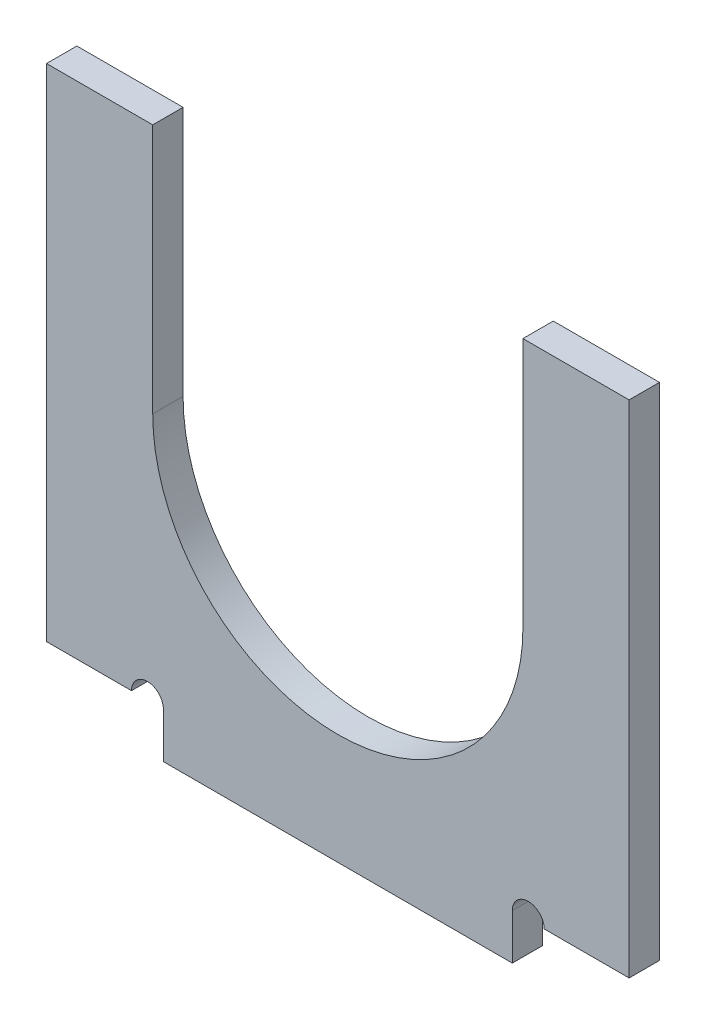
from build123d import *

# Parameters (mm, degrees)
SKETCH_1_W          = 38.4
SKETCH_1_H          = 30
EXTRUDE_1_DEPTH     = 2
CUT_EXTRUDE_1_DEPTH = 2
SKETCH_3_W          = 23
SKETCH_3_H          = 6
EXTRUDE_2_DEPTH     = 2
SKETCH_4_R          = 1.05
CUT_EXTRUDE_2_DEPTH = 2
SKETCH_5_W          = 7
SKETCH_5_H          = 3
EXTRUDE_3_DEPTH     = 2


with BuildPart() as part:
    # 草图1 → 凸台-拉伸1 (new body)
    with BuildSketch(Plane.XY):
        Rectangle(SKETCH_1_W, SKETCH_1_H)
    extrude(amount=EXTRUDE_1_DEPTH)

    # 草图2 → 切除-拉伸1 (cut)
    with BuildSketch(Plane(origin=(0, 0, 0), x_dir=(-1, 0, 0), z_dir=(0, 0, -1))):
        with BuildLine():
            Line((-12.2, 1.5), (-12.2, 15))
            Line((-12.2, 15), (12.2, 15))
            Line((12.2, 15), (12.2, 1.5))
            ThreePointArc((12.2, 1.5), (0, -10.7), (-12.2, 1.5))
        make_face()
    extrude(amount=-CUT_EXTRUDE_1_DEPTH, mode=Mode.SUBTRACT)

    # 草图3 → 凸台-拉伸2 (add)
    with BuildSketch(Plane(origin=(0, 0, 0), x_dir=(-1, 0, 0), z_dir=(0, 0, -1))):
        with Locations((0, -15)):
            Rectangle(SKETCH_3_W, SKETCH_3_H)
    extrude(amount=-EXTRUDE_2_DEPTH)

    # 草图4 → 切除-拉伸2 (cut)
    with BuildSketch(Plane.XY.offset(2)):
        with Locations((12.55, -15)):
            Circle(SKETCH_4_R)
        with Locations((-12.55, -15)):
            Circle(SKETCH_4_R)
    extrude(amount=-CUT_EXTRUDE_2_DEPTH, mode=Mode.SUBTRACT)

    # 草图5 → 凸台-拉伸3 (add)
    with BuildSketch(Plane(origin=(0, 0, 0), x_dir=(-1, 0, 0), z_dir=(0, 0, -1))):
        with Locations((-15.7, 16.5)):
            Rectangle(SKETCH_5_W, SKETCH_5_H)
        with Locations((15.7, 16.5)):
            Rectangle(SKETCH_5_W, SKETCH_5_H)
    extrude(amount=-EXTRUDE_3_DEPTH)


solid = part.part
